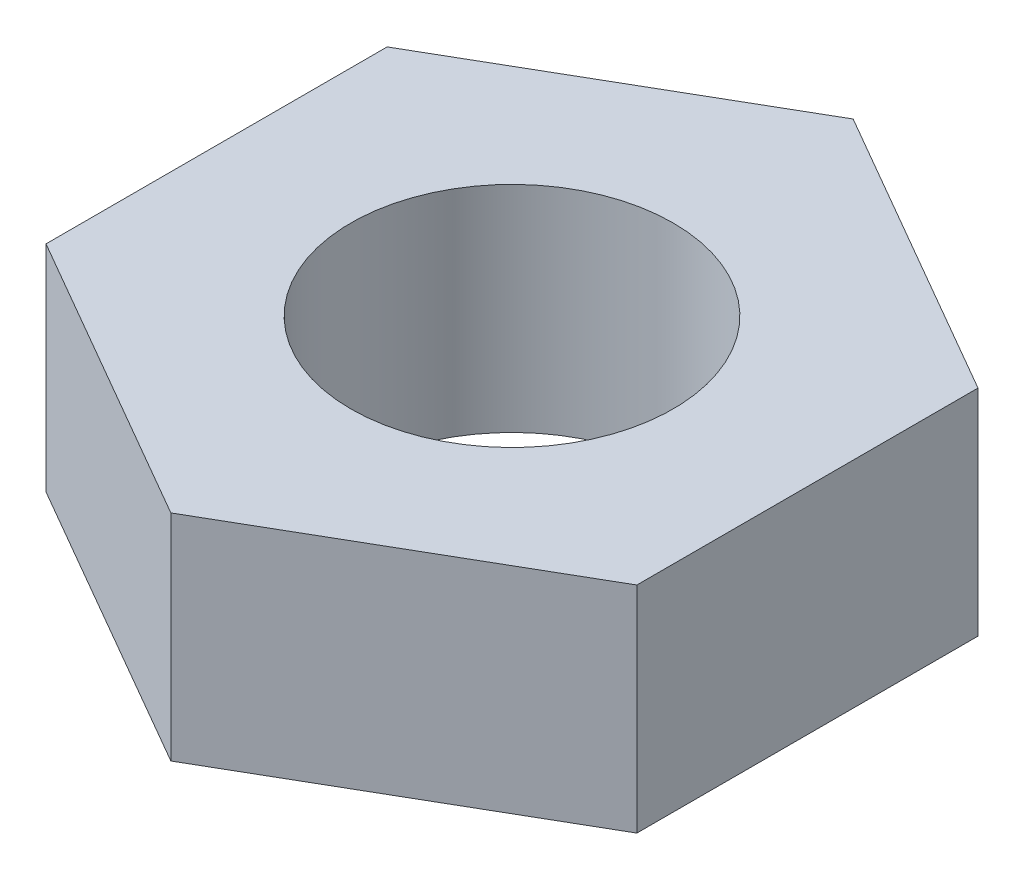
from build123d import *

# Parameters (mm, degrees)
SKETCH_1_R      = 1.5
EXTRUDE_1_DEPTH = 2


with BuildPart() as part:
    # 草图1 → 凸台-拉伸1 (new body)
    with BuildSketch(Plane(origin=(0, 0, 0), x_dir=(1, 0, 0), z_dir=(0, 1, 0))):
        Polygon((0, 3.175426481), (-2.75, 1.58771324), (-2.75, -1.58771324), (0, -3.175426481), (2.75, -1.58771324), (2.75, 1.58771324), align=None)
        with Locations(Location((0, 0, 0), (0, 0, 270))):
            Circle(SKETCH_1_R, mode=Mode.SUBTRACT)
    extrude(amount=EXTRUDE_1_DEPTH)


solid = part.part
